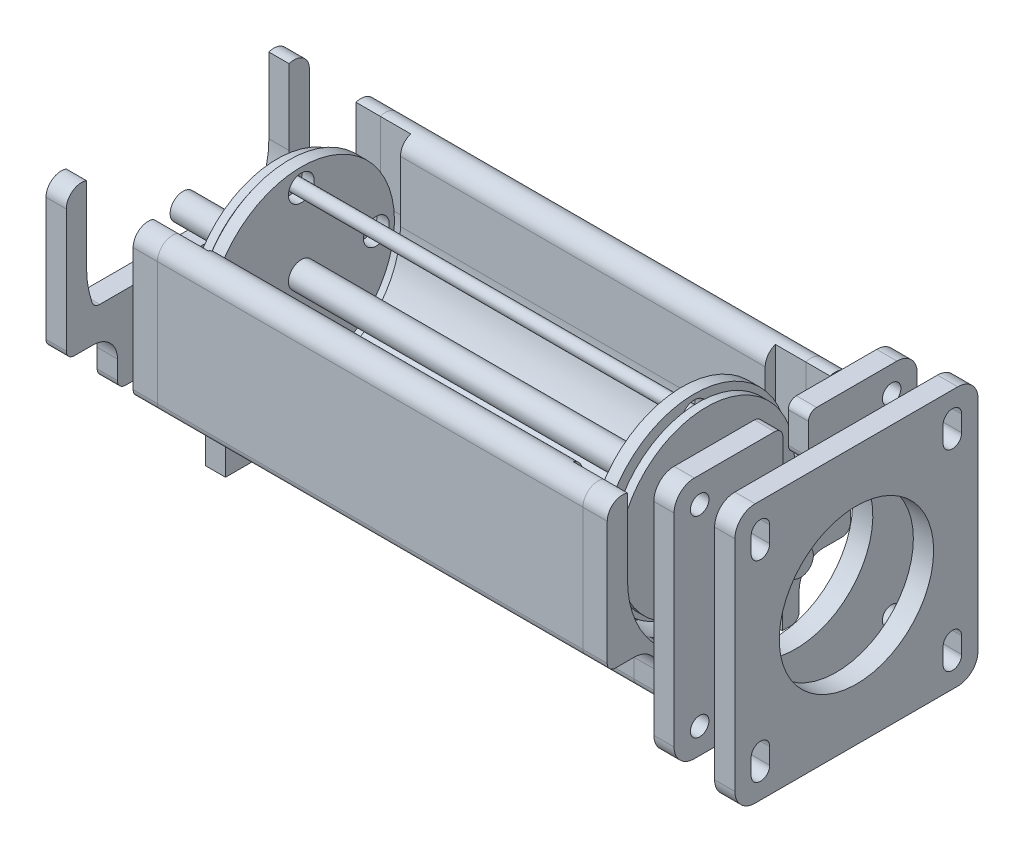
from build123d import *

# Parameters (mm, degrees)
SKETCH2_R                = 23
SKETCH2_R_2              = 3.175
BOSS_EXTRUDE2_DEPTH      = 3
BOSS_EXTRUDE3_DEPTH      = 90
FILLET1_R                = 2
SKETCH16_R               = 21.6875
SKETCH16_R_2             = 3.175
BOSS_EXTRUDE7_DEPTH      = 2
SKETCH21_R               = 1.5875
COMPRESSION_RODS_DEPTH   = 50.8
COMPRESSION_RODS_2_DEPTH = 50.8
COMPRESSION_RODS_3_DEPTH = 50.8
COMPRESSION_RODS_4_DEPTH = 50.8
BOSS_EXTRUDE13_DEPTH     = 7.5
FILLET4_R                = 2
SKETCH25_R               = 6.35
BOSS_EXTRUDE14_DEPTH     = 5
BOSS_EXTRUDE15_DEPTH     = 6
BOSS_EXTRUDE15_2_DEPTH   = 6
SKETCH27_R               = 2.286
BOSS_EXTRUDE17_DEPTH     = 5
FILLET7_R                = 2
FILLET8_R                = 2
SKETCH28_R               = 3.175
BOSS_EXTRUDE19_DEPTH     = 76.2
SKETCH30_R               = 19.05
BOSS_EXTRUDE21_DEPTH     = 5
BOSS_EXTRUDE22_DEPTH     = 5


with BuildPart() as part:
    # Sketch2 → Boss-Extrude2 (new body)
    with BuildSketch(Plane(origin=(-50, 0, 0), x_dir=(0, 0, -1), z_dir=(1, 0, 0))):
        Circle(SKETCH2_R)
        Circle(SKETCH2_R_2, mode=Mode.SUBTRACT)
        with Locations((0, 18.5125)):
            Circle(SKETCH2_R_2, mode=Mode.SUBTRACT)
        with Locations((-18.5125, 0)):
            Circle(SKETCH2_R_2, mode=Mode.SUBTRACT)
        with Locations((0, -18.5125)):
            Circle(SKETCH2_R_2, mode=Mode.SUBTRACT)
        with Locations((18.5125, 0)):
            Circle(SKETCH2_R_2, mode=Mode.SUBTRACT)
    extrude(amount=BOSS_EXTRUDE2_DEPTH)


with BuildPart() as body_2:
    # Sketch3 → Boss-Extrude3 (new body)
    with BuildSketch(Plane(origin=(45, 0, 0), x_dir=(0, 0, -1), z_dir=(1, 0, 0))):
        with BuildLine():
            Line((-22.48125, 0), (-22.48125, 15))
            ThreePointArc((-22.48125, 15), (-26.240625, 18.759375), (-30, 15))
            Line((-30, 15), (-30, -17.371))
            Line((-30, -17.371), (-23.371, -17.371))
            ThreePointArc((-23.371, -17.371), (-19.128359313, -19.128359313), (-17.371, -23.371))
            Line((-17.371, -23.371), (-17.371, -30))
            Line((-17.371, -30), (17.371, -30))
            Line((17.371, -30), (17.371, -23.371))
            ThreePointArc((17.371, -23.371), (19.128359313, -19.128359313), (23.371, -17.371))
            Line((23.371, -17.371), (30, -17.371))
            Line((30, -17.371), (30, 15))
            ThreePointArc((30, 15), (26.240625, 18.759375), (22.48125, 15))
            Line((22.48125, 15), (22.48125, 0))
            ThreePointArc((22.48125, 0), (0, -22.48125), (-22.48125, 0))
        make_face()
    extrude(amount=-BOSS_EXTRUDE3_DEPTH)

    # Fillet1
    fillet1_edges = [body_2.edges().sort_by_distance(p)[0] for p in [
        (0, -17.371, -30),
        (0, -30, -17.371),
        (0, -30, 17.371),
        (0, -17.371, 30),
    ]]
    fillet(fillet1_edges, radius=FILLET1_R)


with BuildPart() as body_3:
    # Sketch16 → Boss-Extrude7 (new body)
    with BuildSketch(Plane(origin=(-51, 0, 0), x_dir=(0, 0, -1), z_dir=(1, 0, 0))):
        Circle(SKETCH16_R)
        Circle(SKETCH16_R_2, mode=Mode.SUBTRACT)
    extrude(amount=-BOSS_EXTRUDE7_DEPTH)


with BuildPart() as body_4:
    # Sketch21 → Compression_Rods (new, symmetric)
    with BuildSketch(Plane(origin=(0, 0, 0), x_dir=(0, 0, -1), z_dir=(1, 0, 0))):
        with Locations((-18.5125, 0)):
            Circle(SKETCH21_R)
    extrude(amount=COMPRESSION_RODS_DEPTH, both=True)


with BuildPart() as body_5:
    # Sketch21 → Compression_Rods 2 (new, symmetric)
    with BuildSketch(Plane(origin=(0, 0, 0), x_dir=(0, 0, -1), z_dir=(1, 0, 0))):
        with Locations((0, 18.5125)):
            Circle(SKETCH21_R)
    extrude(amount=COMPRESSION_RODS_2_DEPTH, both=True)


with BuildPart() as body_6:
    # Sketch21 → Compression_Rods 3 (new, symmetric)
    with BuildSketch(Plane(origin=(0, 0, 0), x_dir=(0, 0, -1), z_dir=(1, 0, 0))):
        with Locations((18.5125, 0)):
            Circle(SKETCH21_R)
    extrude(amount=COMPRESSION_RODS_3_DEPTH, both=True)


with BuildPart() as body_7:
    # Sketch21 → Compression_Rods 4 (new, symmetric)
    with BuildSketch(Plane(origin=(0, 0, 0), x_dir=(0, 0, -1), z_dir=(1, 0, 0))):
        with Locations((0, -18.5125)):
            Circle(SKETCH21_R)
    extrude(amount=COMPRESSION_RODS_4_DEPTH, both=True)


with BuildPart() as body_8:
    # Mirror2: mirrored copy
    add(part.part.mirror(Plane(origin=(0, 0, 0), x_dir=(0, 0, 1), z_dir=(1, 0, 0))))


with BuildPart() as body_9:
    # Mirror2 2: mirrored copy
    add(body_3.part.mirror(Plane(origin=(0, 0, 0), x_dir=(0, 0, 1), z_dir=(1, 0, 0))))


with BuildPart() as body_10:
    # Sketch24 → Boss-Extrude13 (new body)
    with BuildSketch(Plane(origin=(45, 0, 0), x_dir=(0, 0, -1), z_dir=(1, 0, 0))):
        with BuildLine():
            Line((-25, 0), (-25, 18.548767392))
            ThreePointArc((-25, 18.548767392), (-28.416507095, 18.065687117), (-30, 15))
            Line((-30, 15), (-30, -17.371))
            Line((-30, -17.371), (-23.371, -17.371))
            ThreePointArc((-23.371, -17.371), (-19.128359313, -19.128359313), (-17.371, -23.371))
            Line((-17.371, -23.371), (-17.371, -30))
            Line((-17.371, -30), (17.371, -30))
            Line((17.371, -30), (17.371, -23.371))
            ThreePointArc((17.371, -23.371), (19.128359313, -19.128359313), (23.371, -17.371))
            Line((23.371, -17.371), (30, -17.371))
            Line((30, -17.371), (30, 15))
            ThreePointArc((30, 15), (28.416507095, 18.065687117), (25, 18.548767392))
            Line((25, 18.548767392), (25, 0))
            ThreePointArc((25, 0), (0, -25), (-25, 0))
        make_face()
    extrude(amount=BOSS_EXTRUDE13_DEPTH)

    # Fillet4
    fillet4_edges = [body_10.edges().sort_by_distance(p)[0] for p in [
        (48.75, -17.371, -30),
        (48.75, -30, -17.371),
        (48.75, -30, 17.371),
        (48.75, -17.371, 30),
    ]]
    fillet(fillet4_edges, radius=FILLET4_R)


with BuildPart() as body_11:
    # Sketch25 → Boss-Extrude14 (new body)
    with BuildSketch(Plane(origin=(53, 0, 0), x_dir=(0, 0, -1), z_dir=(1, 0, 0))):
        with BuildLine():
            Line((-12.7, 0), (-12.7, -40))
            Line((-12.7, -40), (12.7, -40))
            Line((12.7, -40), (12.7, 0))
            ThreePointArc((12.7, 0), (0, 12.7), (-12.7, 0))
        make_face()
        Circle(SKETCH25_R, mode=Mode.SUBTRACT)
        with BuildLine():
            Line((-6.35, -12), (-6.35, -31))
            ThreePointArc((-6.35, -31), (-5.178427125, -33.828427125), (-2.35, -35))
            Line((-2.35, -35), (2.35, -35))
            ThreePointArc((2.35, -35), (5.178427125, -33.828427125), (6.35, -31))
            Line((6.35, -31), (6.35, -12))
            ThreePointArc((6.35, -12), (5.178427125, -9.171572875), (2.35, -8))
            Line((2.35, -8), (-2.35, -8))
            ThreePointArc((-2.35, -8), (-5.178427125, -9.171572875), (-6.35, -12))
        make_face(mode=Mode.SUBTRACT)
    extrude(amount=BOSS_EXTRUDE14_DEPTH)


with BuildPart() as body_12:
    # Sketch26 → Boss-Extrude15 (new body)
    with BuildSketch(Plane(origin=(52.5, 0, 0), x_dir=(0, 0, -1), z_dir=(1, 0, 0))):
        with BuildLine():
            Line((-25, 0), (-25, 18.548767392))
            ThreePointArc((-25, 18.548767392), (-28.416507095, 18.065687117), (-30, 15))
            Line((-30, 15), (-30, -17.371))
            Line((-30, -17.371), (-23.371, -17.371))
            ThreePointArc((-23.371, -17.371), (-19.128359313, -19.128359313), (-17.371, -23.371))
            Line((-17.371, -23.371), (-17.371, -30))
            Line((-17.371, -30), (-13.2, -30))
            Line((-13.2, -30), (-13.2, -21.23110925))
            ThreePointArc((-13.2, -21.23110925), (-21.851773383, -12.144957801), (-25, 0))
        make_face()
    extrude(amount=BOSS_EXTRUDE15_DEPTH)

    # Fillet7
    fillet7_edges = [body_12.edges().sort_by_distance(p)[0] for p in [
        (55.5, -30, 17.371),
        (55.5, -17.371, 30),
    ]]
    fillet(fillet7_edges, radius=FILLET7_R)


with BuildPart() as body_13:
    # Sketch26 → Boss-Extrude15 2 (new body)
    with BuildSketch(Plane(origin=(52.5, 0, 0), x_dir=(0, 0, -1), z_dir=(1, 0, 0))):
        with BuildLine():
            Line((13.2, -30), (13.2, -21.23110925))
            ThreePointArc((13.2, -21.23110925), (21.851773383, -12.144957801), (25, 0))
            Line((25, 0), (25, 18.548767392))
            ThreePointArc((25, 18.548767392), (28.416507095, 18.065687117), (30, 15))
            Line((30, 15), (30, -17.371))
            Line((30, -17.371), (23.371, -17.371))
            ThreePointArc((23.371, -17.371), (19.128359313, -19.128359313), (17.371, -23.371))
            Line((17.371, -23.371), (17.371, -30))
            Line((17.371, -30), (13.2, -30))
        make_face()
    extrude(amount=BOSS_EXTRUDE15_2_DEPTH)

    # Fillet8
    fillet8_edges = [body_13.edges().sort_by_distance(p)[0] for p in [
        (55.5, -17.371, -30),
        (55.5, -30, -17.371),
    ]]
    fillet(fillet8_edges, radius=FILLET8_R)


with BuildPart() as body_14:
    # Sketch27 → Boss-Extrude17 (new body)
    with BuildSketch(Plane(origin=(70, 0, 0), x_dir=(0, 0, -1), z_dir=(1, 0, 0))):
        with BuildLine():
            Line((-5.175, 30), (-25, 30))
            ThreePointArc((-25, 30), (-28.535533906, 28.535533906), (-30, 25))
            Line((-30, 25), (-30, -25))
            ThreePointArc((-30, -25), (-28.535533906, -28.535533906), (-25, -30))
            Line((-25, -30), (25, -30))
            ThreePointArc((25, -30), (28.535533906, -28.535533906), (30, -25))
            Line((30, -25), (30, 25))
            ThreePointArc((30, 25), (28.535533906, 28.535533906), (25, 30))
            Line((25, 30), (5.175, 30))
            ThreePointArc((5.175, 30), (3.760786438, 29.414213562), (3.175, 28))
            Line((3.175, 28), (3.175, 20.403967139))
            ThreePointArc((3.175, 20.403967139), (3.596492331, 19.175832969), (4.683313539, 18.465347933))
            ThreePointArc((4.683313539, 18.465347933), (15.035285546, 11.697977968), (19.05, 0))
            ThreePointArc((19.05, 0), (0, -19.05), (-19.05, 0))
            ThreePointArc((-19.05, 0), (-15.035285546, 11.697977968), (-4.683313539, 18.465347933))
            ThreePointArc((-4.683313539, 18.465347933), (-3.596492331, 19.175832969), (-3.175, 20.403967139))
            Line((-3.175, 20.403967139), (-3.175, 28))
            ThreePointArc((-3.175, 28), (-3.760786438, 29.414213562), (-5.175, 30))
        make_face()
        with Locations((-23.6855, 23.6855)):
            Circle(SKETCH27_R, mode=Mode.SUBTRACT)
        with Locations((23.6855, 23.6855)):
            Circle(SKETCH27_R, mode=Mode.SUBTRACT)
        with Locations((-23.6855, -23.6855)):
            Circle(SKETCH27_R, mode=Mode.SUBTRACT)
        with Locations((23.6855, -23.6855)):
            Circle(SKETCH27_R, mode=Mode.SUBTRACT)
    extrude(amount=BOSS_EXTRUDE17_DEPTH)


with BuildPart() as body_15:
    # Mirror5: mirrored copy
    add(body_10.part.mirror(Plane(origin=(0, 0, 0), x_dir=(0, 0, 1), z_dir=(1, 0, 0))))


with BuildPart() as body_16:
    # Mirror6: mirrored copy
    add(body_12.part.mirror(Plane(origin=(0, 0, 0), x_dir=(0, 0, 1), z_dir=(1, 0, 0))))


with BuildPart() as body_17:
    # Mirror6 2: mirrored copy
    add(body_13.part.mirror(Plane(origin=(0, 0, 0), x_dir=(0, 0, 1), z_dir=(1, 0, 0))))


with BuildPart() as body_18:
    # Mirror8: mirrored copy
    add(body_11.part.mirror(Plane(origin=(0, 0, 0), x_dir=(0, 0, 1), z_dir=(1, 0, 0))))


with BuildPart() as part_1:
    add(part.part)

    add(body_3.part)  # Boss-Extrude19 merges body 3

    add(body_8.part)  # Boss-Extrude19 merges body 8

    add(body_9.part)  # Boss-Extrude19 merges body 9

    add(body_11.part)  # Boss-Extrude19 merges body 11

    add(body_18.part)  # Boss-Extrude19 merges body 18

    add(body_2.part)  # Boss-Extrude19 merges body 2

    add(body_10.part)  # Boss-Extrude19 merges body 10

    add(body_15.part)  # Boss-Extrude19 merges body 15
    # Sketch28 → Boss-Extrude19 (add, symmetric)
    with BuildSketch(Plane(origin=(0, 0, 0), x_dir=(0, 0, -1), z_dir=(1, 0, 0))):
        with Locations(Location((0, 0, 0), (0, 0, 180))):
            Circle(SKETCH28_R)
    extrude(amount=BOSS_EXTRUDE19_DEPTH, both=True)


with BuildPart() as body_11_2:
    # Sketch30 → Boss-Extrude21 (new body)
    with BuildSketch(Plane(origin=(85, 0, 0), x_dir=(0, 0, -1), z_dir=(1, 0, 0))):
        with BuildLine():
            Line((-25, 32), (25, 32))
            ThreePointArc((25, 32), (28.535533906, 30.535533906), (30, 27))
            Line((30, 27), (30, -27))
            ThreePointArc((30, -27), (28.535533906, -30.535533906), (25, -32))
            Line((25, -32), (-25, -32))
            ThreePointArc((-25, -32), (-28.535533906, -30.535533906), (-30, -27))
            Line((-30, -27), (-30, 27))
            ThreePointArc((-30, 27), (-28.535533906, 30.535533906), (-25, 32))
        make_face()
        Circle(SKETCH30_R, mode=Mode.SUBTRACT)
        with BuildLine():
            Line((-25.9715, 25.6855), (-25.9715, 21.6855))
            ThreePointArc((-25.9715, 21.6855), (-23.6855, 19.3995), (-21.3995, 21.6855))
            Line((-21.3995, 21.6855), (-21.3995, 25.6855))
            ThreePointArc((-21.3995, 25.6855), (-23.6855, 27.9715), (-25.9715, 25.6855))
        make_face(mode=Mode.SUBTRACT)
        with BuildLine():
            Line((21.3995, 25.6855), (21.3995, 21.6855))
            ThreePointArc((21.3995, 21.6855), (23.6855, 19.3995), (25.9715, 21.6855))
            Line((25.9715, 21.6855), (25.9715, 25.6855))
            ThreePointArc((25.9715, 25.6855), (23.6855, 27.9715), (21.3995, 25.6855))
        make_face(mode=Mode.SUBTRACT)
        with BuildLine():
            Line((25.9715, -25.6855), (25.9715, -21.6855))
            ThreePointArc((25.9715, -21.6855), (23.6855, -19.3995), (21.3995, -21.6855))
            Line((21.3995, -21.6855), (21.3995, -25.6855))
            ThreePointArc((21.3995, -25.6855), (23.6855, -27.9715), (25.9715, -25.6855))
        make_face(mode=Mode.SUBTRACT)
        with BuildLine():
            Line((-21.3995, -25.6855), (-21.3995, -21.6855))
            ThreePointArc((-21.3995, -21.6855), (-23.6855, -19.3995), (-25.9715, -21.6855))
            Line((-25.9715, -21.6855), (-25.9715, -25.6855))
            ThreePointArc((-25.9715, -25.6855), (-23.6855, -27.9715), (-21.3995, -25.6855))
        make_face(mode=Mode.SUBTRACT)
    extrude(amount=BOSS_EXTRUDE21_DEPTH)


with BuildPart() as body_12_2:
    # Sketch34 → Boss-Extrude22 (new body)
    with BuildSketch(Plane(origin=(-75, 0, 0), x_dir=(0, 0, -1), z_dir=(1, 0, 0))):
        with BuildLine():
            Line((-25, 0), (-25, 18.548767392))
            ThreePointArc((-25, 18.548767392), (-28.416507095, 18.065687117), (-30, 15))
            Line((-30, 15), (-30, -15.371))
            ThreePointArc((-30, -15.371), (-29.414213562, -16.785213562), (-28, -17.371))
            Line((-28, -17.371), (-23.371, -17.371))
            ThreePointArc((-23.371, -17.371), (-19.128359313, -19.128359313), (-17.371, -23.371))
            Line((-17.371, -23.371), (-17.371, -28))
            ThreePointArc((-17.371, -28), (-16.785213562, -29.414213562), (-15.371, -30))
            Line((-15.371, -30), (15.371, -30))
            ThreePointArc((15.371, -30), (16.785213562, -29.414213562), (17.371, -28))
            Line((17.371, -28), (17.371, -23.371))
            ThreePointArc((17.371, -23.371), (19.128359313, -19.128359313), (23.371, -17.371))
            Line((23.371, -17.371), (28, -17.371))
            ThreePointArc((28, -17.371), (29.414213562, -16.785213562), (30, -15.371))
            Line((30, -15.371), (30, 15))
            ThreePointArc((30, 15), (28.416507095, 18.065687117), (25, 18.548767392))
            Line((25, 18.548767392), (25, 0))
            ThreePointArc((25, 0), (24.653626397, -4.147132198), (23.624103563, -8.179347826))
            ThreePointArc((23.624103563, -8.179347826), (22.894197766, -9.154216936), (21.734175278, -9.525))
            Line((21.734175278, -9.525), (-21.734175278, -9.525))
            ThreePointArc((-21.734175278, -9.525), (-22.894197766, -9.154216936), (-23.624103563, -8.179347826))
            ThreePointArc((-23.624103563, -8.179347826), (-24.653626397, -4.147132198), (-25, 0))
        make_face()
    extrude(amount=-BOSS_EXTRUDE22_DEPTH)


solid = Compound([body_4.part, body_5.part, body_6.part, body_7.part, body_12.part, body_13.part, body_14.part, body_16.part, body_17.part, part_1.part, body_11_2.part, body_12_2.part])
